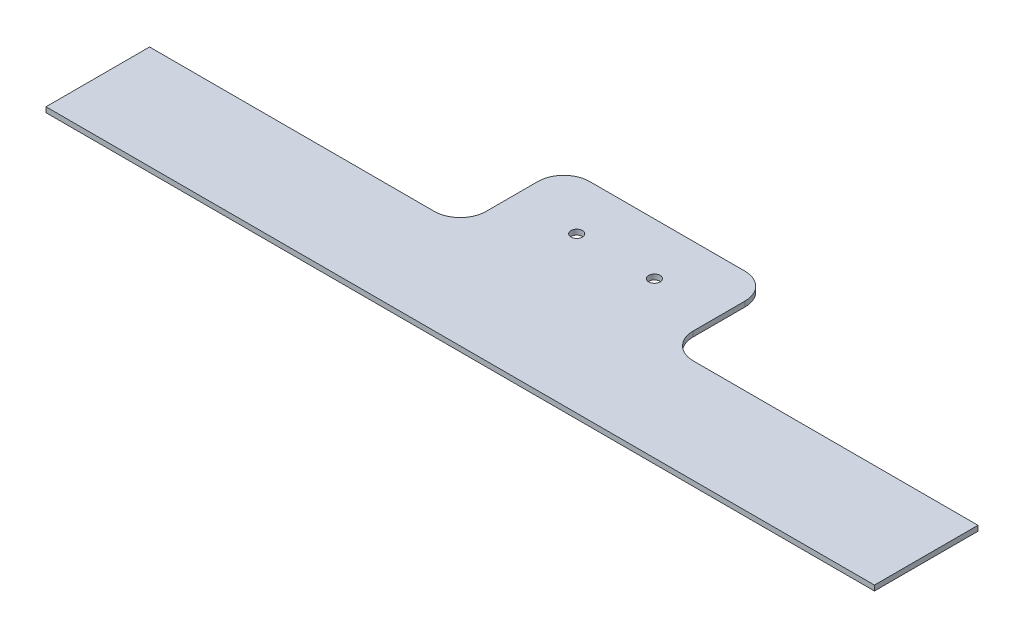
from build123d import *

# Parameters (mm, degrees)
SKETCH1_W           = 406.4
SKETCH1_H           = 50.8
SKETCH1_W_2         = 101.6
BOSS_EXTRUDE1_DEPTH = 2.54
SKETCH2_R           = 2.794
CUT_EXTRUDE1_DEPTH  = 2.54
FILLET1_R           = 12.7
FILLET2_R           = 12.7


with BuildPart() as part:
    # Sketch1 → Boss-Extrude1 (new body)
    with BuildSketch(Plane(origin=(0, 0, 0), x_dir=(1, 0, 0), z_dir=(0, 1, 0))):
        with Locations((203.2, 25.4)):
            Rectangle(SKETCH1_W, SKETCH1_H)
        with Locations((203.2, 76.2)):
            Rectangle(SKETCH1_W_2, SKETCH1_H)
    extrude(amount=BOSS_EXTRUDE1_DEPTH)

    # Sketch2 → Cut-Extrude1 (cut)
    with BuildSketch(Plane(origin=(0, 2.54, 0), x_dir=(1, 0, 0), z_dir=(0, 1, 0))):
        with Locations(Location((222.25, 76.2, 0), (0, 0, 270))):
            Circle(SKETCH2_R)
        with Locations(Location((184.15, 76.2, 0), (0, 0, 270))):
            Circle(SKETCH2_R)
    extrude(amount=-CUT_EXTRUDE1_DEPTH, mode=Mode.SUBTRACT)

    # Fillet1
    fillet1_edges = [part.edges().sort_by_distance(p)[0] for p in [
        (152.4, 1.27, -101.6),
        (254, 1.27, -101.6),
    ]]
    fillet(fillet1_edges, radius=FILLET1_R)

    # Fillet2
    fillet2_edges = [part.edges().sort_by_distance(p)[0] for p in [
        (152.4, 1.27, -50.8),
        (254, 1.27, -50.8),
    ]]
    fillet(fillet2_edges, radius=FILLET2_R)


solid = part.part
